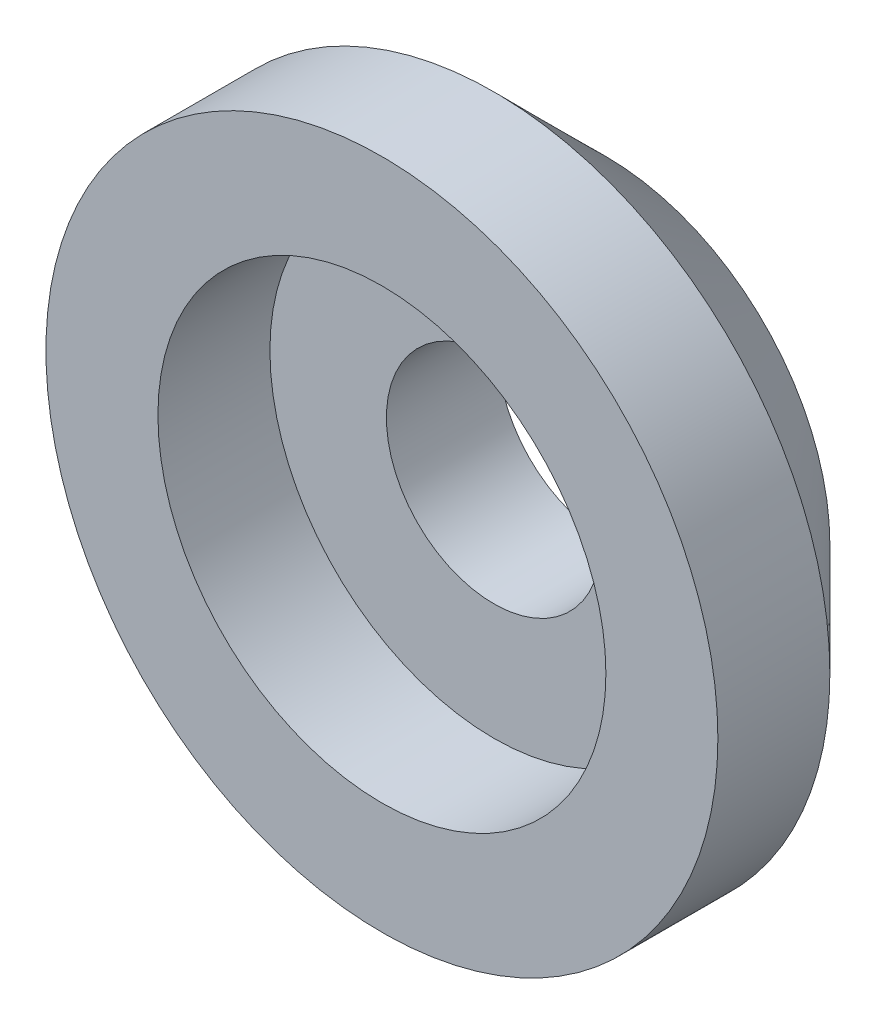
from build123d import *

# Parameters (mm, degrees)
SKETCH1_R           = 7.5
BOSS_EXTRUDE1_DEPTH = 5
SKETCH2_R           = 5
CUT_EXTRUDE1_DEPTH  = 2.5
CHAMFER1_SIZE       = 2.5
SKETCH3_R           = 2.4
CUT_EXTRUDE2_DEPTH  = 2.5


with BuildPart() as part:
    # Sketch1 → Boss-Extrude1 (new body)
    with BuildSketch(Plane.XY):
        Circle(SKETCH1_R)
    extrude(amount=BOSS_EXTRUDE1_DEPTH)

    # Sketch2 → Cut-Extrude1 (cut)
    with BuildSketch(Plane.XY.offset(5)):
        Circle(SKETCH2_R)
    extrude(amount=-CUT_EXTRUDE1_DEPTH, mode=Mode.SUBTRACT)

    # Chamfer1
    chamfer1_edges = [part.edges().sort_by_distance(p)[0] for p in [
        (-7.5, 0, 0),
    ]]
    chamfer(chamfer1_edges, length=CHAMFER1_SIZE)

    # Sketch3 → Cut-Extrude2 (cut)
    with BuildSketch(Plane.XY.offset(2.5)):
        Circle(SKETCH3_R)
    extrude(amount=-CUT_EXTRUDE2_DEPTH, mode=Mode.SUBTRACT)


solid = part.part
